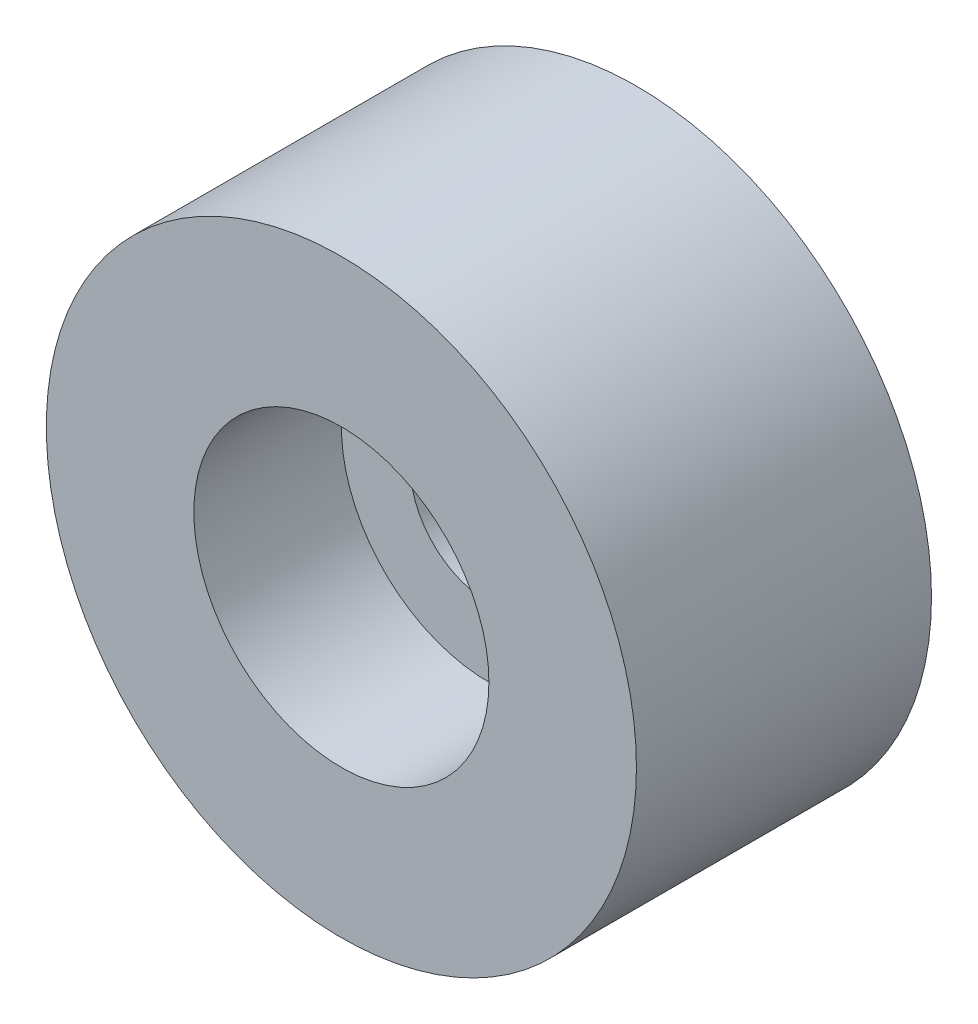
from build123d import *

# Parameters (mm, degrees)
SKETCH_1_R          = 6
EXTRUDE_1_DEPTH     = 6
SKETCH_1_4_R        = 3
CUT_EXTRUDE_2_DEPTH = 3
HOLE_WIZARD_M3_1_D  = 3.2


with BuildPart() as part:
    # ｽｹｯﾁ1 → ﾎﾞｽ - 押し出し1 (new body)
    with BuildSketch(Plane.XY):
        Circle(SKETCH_1_R)
    extrude(amount=-EXTRUDE_1_DEPTH)

    # ｽｹｯﾁ1<4> → ｶｯﾄ - 押し出し2 (cut)
    with BuildSketch(Plane.XY):
        Circle(SKETCH_1_4_R)
    extrude(amount=-CUT_EXTRUDE_2_DEPTH, mode=Mode.SUBTRACT)

    # M3 すきま穴1 (through all)
    with Locations(Plane(origin=(0, 0, -6), x_dir=(-1, 0, 0), z_dir=(0, 0, -1))):
        with Locations((0, 0)):
            Hole(HOLE_WIZARD_M3_1_D / 2)


solid = part.part
